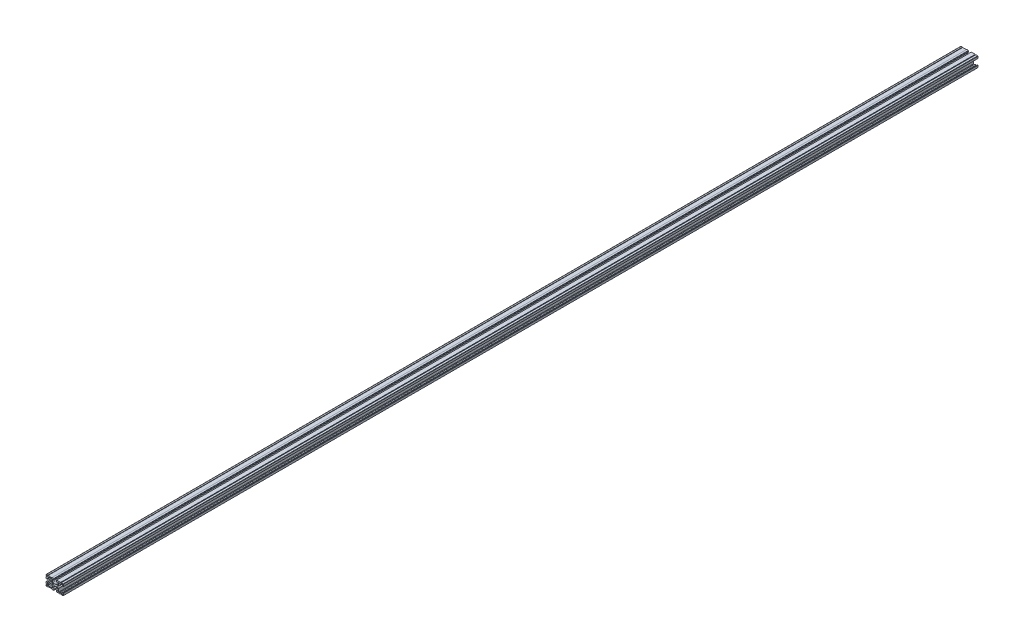
from build123d import *

# Parameters (mm, degrees)
EXTRUDE1_DEPTH = 3962.4


with BuildPart() as part:
    # Sketch1 → Extrude1 (new body)
    with BuildSketch(Plane.XY):
        with BuildLine():
            Line((-8.042370933, 6.520154777), (-2.17182791, 4.383451858))
            ThreePointArc((-2.17182791, 4.383451858), (0, 4.0005), (2.17182791, 4.383451858))
            Line((2.17182791, 4.383451858), (8.042370933, 6.520154777))
            ThreePointArc((8.042370933, 6.520154777), (10.314711611, 8.263783106), (11.176, 10.995440884))
            Line((11.176, 10.995440884), (11.176, 16.383))
            Line((11.176, 16.383), (5.207, 16.383))
            Line((5.207, 16.383), (5.207, 20.6756))
            Line((5.207, 20.6756), (6.0452, 20.6756))
            Line((6.0452, 20.6756), (6.0452, 22.352))
            Line((6.0452, 22.352), (23.114, 22.352))
            Line((23.114, 22.352), (23.114, 19.685))
            Line((23.114, 19.685), (26.162, 19.685))
            Line((26.162, 19.685), (26.162, 22.352))
            Line((26.162, 22.352), (34.163, 22.352))
            Line((34.163, 22.352), (34.163, 21.082))
            Line((34.163, 21.082), (35.052, 21.082))
            Line((35.052, 21.082), (35.052, 12.6365))
            Line((35.052, 12.6365), (33.147, 12.6365))
            Line((33.147, 12.6365), (32.299669473, 16.458561015))
            ThreePointArc((32.299669473, 16.458561015), (30.491287752, 19.961550786), (27.432, 17.4752))
            Line((27.432, 17.4752), (27.432, 15.5194))
            Line((27.432, 15.5194), (23.114, 15.5194))
            ThreePointArc((23.114, 15.5194), (21.080787287, 15.97522468), (19.436777108, 17.255443647))
            ThreePointArc((19.436777108, 17.255443647), (18.156613066, 17.872739697), (16.7513, 18.0848))
            Line((16.7513, 18.0848), (14.986, 18.0848))
            Line((14.986, 18.0848), (14.986, 4.448989638))
            ThreePointArc((14.986, 4.448989638), (14.705787924, 3.922348841), (14.112455026, 3.860498945))
            ThreePointArc((14.112455026, 3.860498945), (8.382, 0), (14.112455026, -3.860498945))
            ThreePointArc((14.112455026, -3.860498945), (14.705787924, -3.922348841), (14.986, -4.448989638))
            Line((14.986, -4.448989638), (14.986, -18.0848))
            Line((14.986, -18.0848), (16.7513, -18.0848))
            ThreePointArc((16.7513, -18.0848), (18.156613066, -17.872739697), (19.436777108, -17.255443647))
            ThreePointArc((19.436777108, -17.255443647), (21.080787287, -15.97522468), (23.114, -15.5194))
            Line((23.114, -15.5194), (27.432, -15.5194))
            Line((27.432, -15.5194), (27.432, -17.4752))
            ThreePointArc((27.432, -17.4752), (30.491287752, -19.961550786), (32.299669473, -16.458561015))
            Line((32.299669473, -16.458561015), (33.147, -12.6365))
            Line((33.147, -12.6365), (35.052, -12.6365))
            Line((35.052, -12.6365), (35.052, -21.082))
            Line((35.052, -21.082), (34.163, -21.082))
            Line((34.163, -21.082), (34.163, -22.352))
            Line((34.163, -22.352), (26.162, -22.352))
            Line((26.162, -22.352), (26.162, -19.685))
            Line((26.162, -19.685), (23.114, -19.685))
            Line((23.114, -19.685), (23.114, -22.352))
            Line((23.114, -22.352), (6.0452, -22.352))
            Line((6.0452, -22.352), (6.0452, -20.6756))
            Line((6.0452, -20.6756), (5.207, -20.6756))
            Line((5.207, -20.6756), (5.207, -16.383))
            Line((5.207, -16.383), (11.176, -16.383))
            Line((11.176, -16.383), (11.176, -10.995440884))
            ThreePointArc((11.176, -10.995440884), (10.314711611, -8.263783106), (8.042370933, -6.520154777))
            Line((8.042370933, -6.520154777), (2.17182791, -4.383451858))
            ThreePointArc((2.17182791, -4.383451858), (0, -4.0005), (-2.17182791, -4.383451858))
            Line((-2.17182791, -4.383451858), (-8.042370933, -6.520154777))
            ThreePointArc((-8.042370933, -6.520154777), (-10.314711611, -8.263783106), (-11.176, -10.995440884))
            Line((-11.176, -10.995440884), (-11.176, -16.383))
            Line((-11.176, -16.383), (-5.207, -16.383))
            Line((-5.207, -16.383), (-5.207, -20.6756))
            Line((-5.207, -20.6756), (-6.0452, -20.6756))
            Line((-6.0452, -20.6756), (-6.0452, -22.352))
            Line((-6.0452, -22.352), (-13.8176, -22.352))
            Line((-13.8176, -22.352), (-13.8176, -20.828))
            Line((-13.8176, -20.828), (-31.4452, -20.828))
            Line((-31.4452, -20.828), (-31.4452, -22.352))
            Line((-31.4452, -22.352), (-36.957, -22.352))
            ThreePointArc((-36.957, -22.352), (-39.20206403, -21.42206403), (-40.132, -19.177))
            Line((-40.132, -19.177), (-40.132, -17.4879))
            Line((-40.132, -17.4879), (-38.227, -17.4879))
            Line((-38.227, -17.4879), (-37.514055794, -18.753357925))
            ThreePointArc((-37.514055794, -18.753357925), (-32.852848443, -18.390189081), (-36.134047833, -15.059652167))
            Line((-36.134047833, -15.059652167), (-38.227, -12.9667))
            Line((-38.227, -12.9667), (-40.132, -12.9667))
            Line((-40.132, -12.9667), (-40.132, -5.9055))
            Line((-40.132, -5.9055), (-38.481, -5.9055))
            Line((-38.481, -5.9055), (-38.481, -5.0165))
            Line((-38.481, -5.0165), (-34.163, -5.0165))
            Line((-34.163, -5.0165), (-34.163, -10.9982))
            Line((-34.163, -10.9982), (-29.083, -10.9982))
            Line((-29.083, -10.9982), (-29.083, -13.843))
            ThreePointArc((-29.083, -13.843), (-28.15306403, -16.08806403), (-25.908, -17.018))
            Line((-25.908, -17.018), (-14.986, -17.018))
            Line((-14.986, -17.018), (-14.986, -4.448989638))
            ThreePointArc((-14.986, -4.448989638), (-14.705787924, -3.922348841), (-14.112455026, -3.860498945))
            ThreePointArc((-14.112455026, -3.860498945), (-8.382, 0), (-14.112455026, 3.860498945))
            ThreePointArc((-14.112455026, 3.860498945), (-14.705787924, 3.922348841), (-14.986, 4.448989638))
            Line((-14.986, 4.448989638), (-14.986, 17.018))
            Line((-14.986, 17.018), (-25.908, 17.018))
            ThreePointArc((-25.908, 17.018), (-28.15306403, 16.08806403), (-29.083, 13.843))
            Line((-29.083, 13.843), (-29.083, 10.9982))
            Line((-29.083, 10.9982), (-34.163, 10.9982))
            Line((-34.163, 10.9982), (-34.163, 5.0165))
            Line((-34.163, 5.0165), (-38.481, 5.0165))
            Line((-38.481, 5.0165), (-38.481, 5.9055))
            Line((-38.481, 5.9055), (-40.132, 5.9055))
            Line((-40.132, 5.9055), (-40.132, 12.9667))
            Line((-40.132, 12.9667), (-38.227, 12.9667))
            Line((-38.227, 12.9667), (-36.134047833, 15.059652167))
            ThreePointArc((-36.134047833, 15.059652167), (-32.852848443, 18.390189081), (-37.514055794, 18.753357925))
            Line((-37.514055794, 18.753357925), (-38.227, 17.4879))
            Line((-38.227, 17.4879), (-40.132, 17.4879))
            Line((-40.132, 17.4879), (-40.132, 19.177))
            ThreePointArc((-40.132, 19.177), (-39.20206403, 21.42206403), (-36.957, 22.352))
            Line((-36.957, 22.352), (-31.4452, 22.352))
            Line((-31.4452, 22.352), (-31.4452, 20.828))
            Line((-31.4452, 20.828), (-13.8176, 20.828))
            Line((-13.8176, 20.828), (-13.8176, 22.352))
            Line((-13.8176, 22.352), (-6.0452, 22.352))
            Line((-6.0452, 22.352), (-6.0452, 20.6756))
            Line((-6.0452, 20.6756), (-5.207, 20.6756))
            Line((-5.207, 20.6756), (-5.207, 16.383))
            Line((-5.207, 16.383), (-11.176, 16.383))
            Line((-11.176, 16.383), (-11.176, 10.995440884))
            ThreePointArc((-11.176, 10.995440884), (-10.314711611, 8.263783106), (-8.042370933, 6.520154777))
        make_face()
    extrude(amount=EXTRUDE1_DEPTH)


solid = part.part
